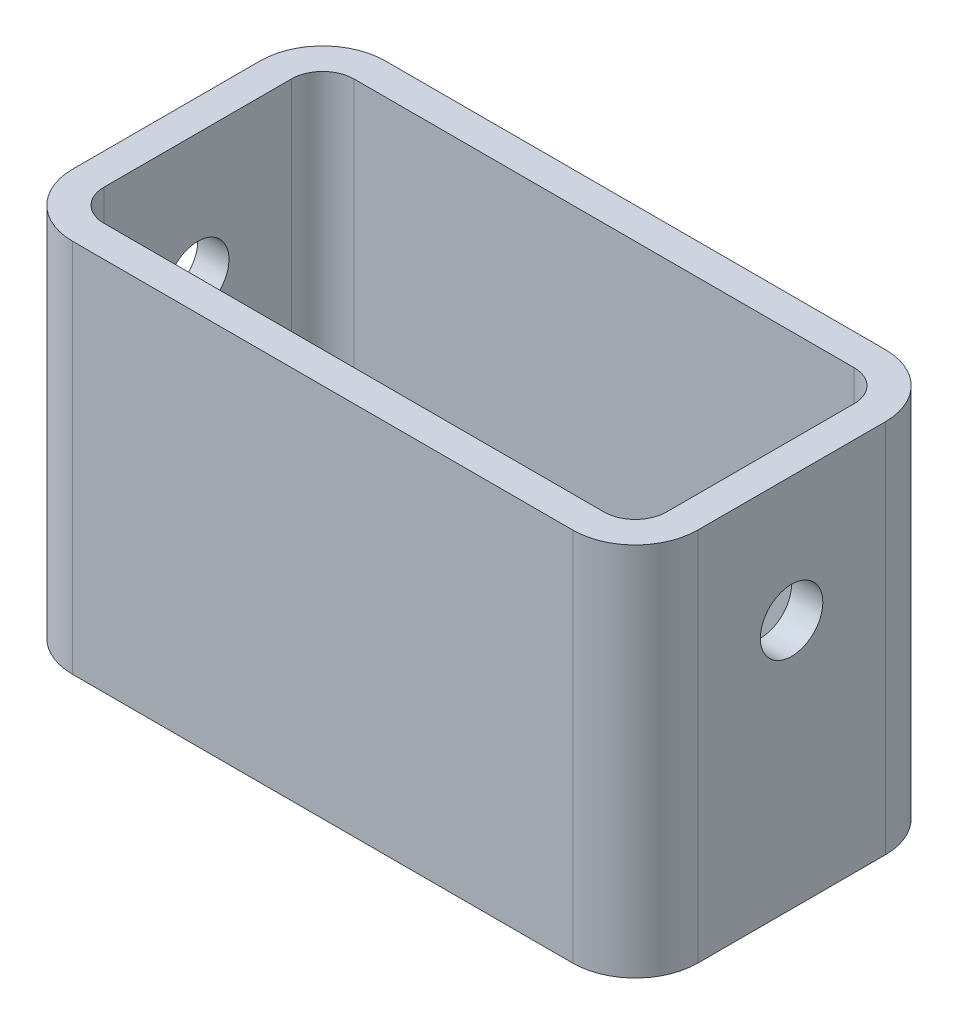
from build123d import *

# Parameters (mm, degrees)
SKETCH1_W           = 100
SKETCH1_H           = 60
BOSS_EXTRUDE1_DEPTH = 50
FILLET1_R           = 10
SHELL1_T            = -5
SKETCH3_R           = 5
CUT_EXTRUDE1_DEPTH  = 127.885775404


with BuildPart() as part:
    # Sketch1 → Boss-Extrude1 (new body)
    with BuildSketch(Plane.XY):
        with Locations((50, -30)):
            Rectangle(SKETCH1_W, SKETCH1_H)
    extrude(amount=BOSS_EXTRUDE1_DEPTH)

    # Fillet1
    fillet1_edges = [part.edges().sort_by_distance(p)[0] for p in [
        (100, -30, 50),
        (0, -30, 50),
        (100, -30, 0),
        (0, -30, 0),
    ]]
    fillet(fillet1_edges, radius=FILLET1_R)

    # Shell1
    shell1_openings = [part.faces().sort_by_distance(p)[0] for p in [
        (50, 0, 25),
    ]]
    offset(amount=SHELL1_T, openings=shell1_openings, kind=Kind.INTERSECTION)

    # Sketch3 → Cut-Extrude1 (cut, through all)
    with BuildSketch(Plane(origin=(100, 0, 0), x_dir=(0, 0, -1), z_dir=(1, 0, 0))):
        with Locations(Location((-25, -20, 0), (0, 0, 90))):
            Circle(SKETCH3_R)
    extrude(amount=-CUT_EXTRUDE1_DEPTH, mode=Mode.SUBTRACT)


solid = part.part
